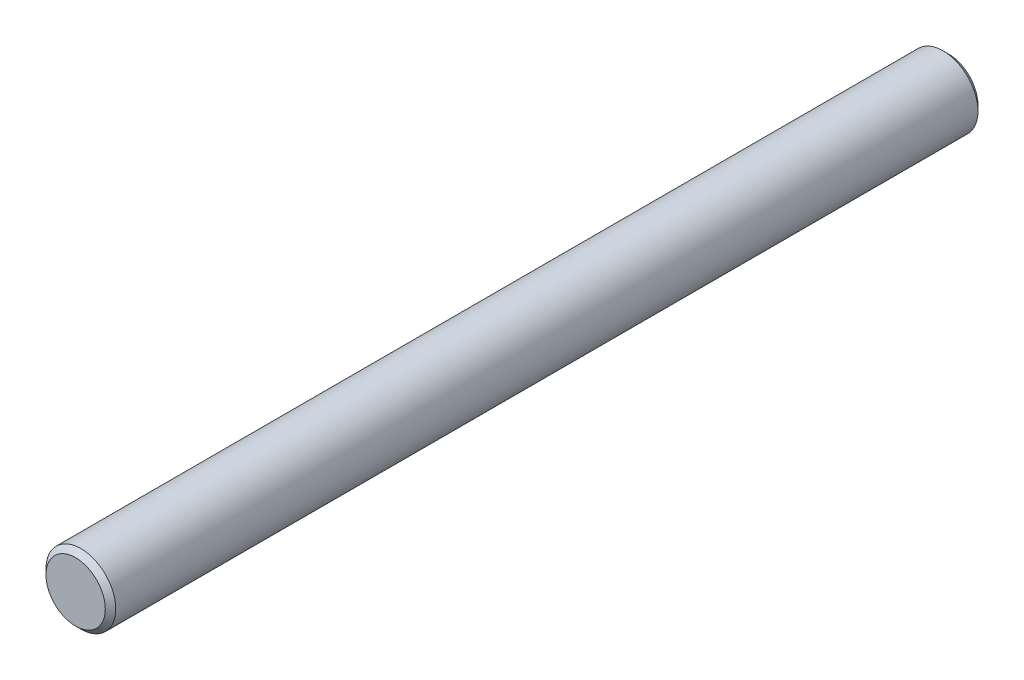
from build123d import *

# Parameters (mm, degrees)
BOSS_EXTRUDE1_DEPTH      = 50
BOSS_EXTRUDE1_DEPTH_BACK = 50
SKETCH3_R                = 4
CHAMFER1_SIZE            = 0.6


with BuildPart() as part:
    # Sketch3 → Boss-Extrude1 (new, two sides: drawn at the far end of the back side and taken through both)
    with BuildSketch(Plane.XY.offset(-BOSS_EXTRUDE1_DEPTH_BACK)):
        Circle(SKETCH3_R)
    extrude(amount=BOSS_EXTRUDE1_DEPTH + BOSS_EXTRUDE1_DEPTH_BACK)

    # Chamfer1
    chamfer1_edges = [part.edges().sort_by_distance(p)[0] for p in [
        (-4, 0, -50),
        (-4, 0, 50),
    ]]
    chamfer(chamfer1_edges, length=CHAMFER1_SIZE)


solid = part.part
